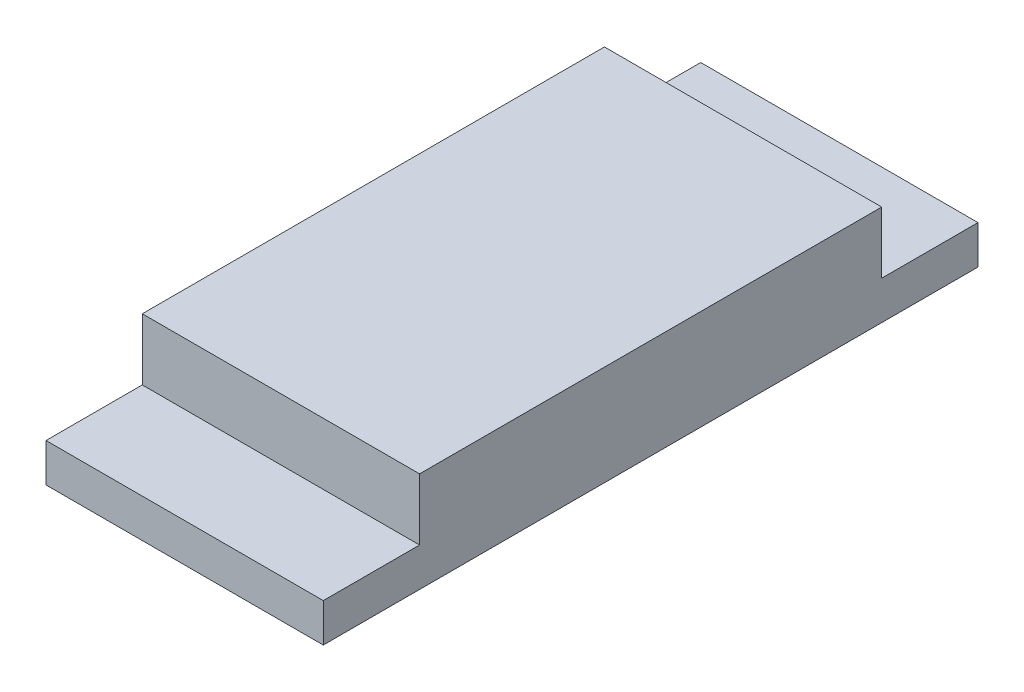
from build123d import *

# Parameters (mm, degrees)
BOSS_EXTRUDE1_DEPTH = 36


with BuildPart() as part:
    # Sketch1 → Boss-Extrude1 (new body)
    with BuildSketch(Plane(origin=(0, 0, 0), x_dir=(0, 0, -1), z_dir=(1, 0, 0))):
        Polygon((0, 0), (85, 0), (85, 5), (72.5, 5), (72.5, 13), (12.5, 13), (12.5, 5), (0, 5), align=None)
    extrude(amount=BOSS_EXTRUDE1_DEPTH)


solid = part.part
